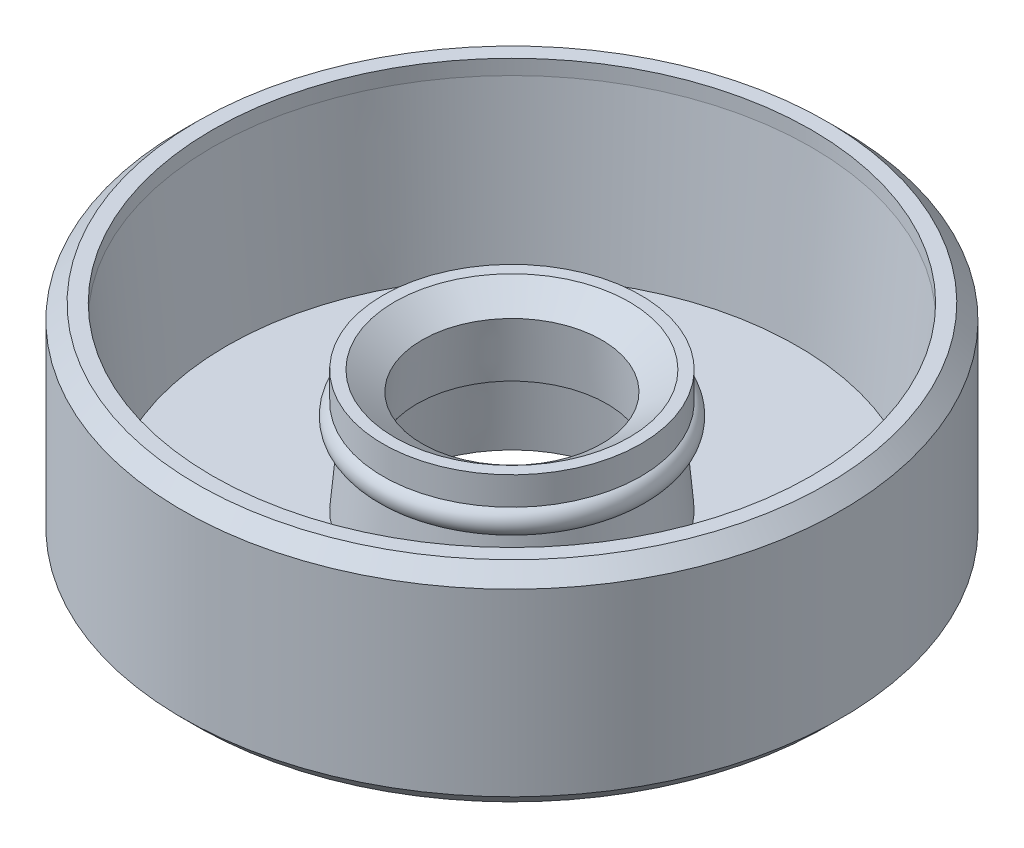
from build123d import *


with BuildPart() as part:
    # 草图1 → 旋转1 (revolve)
    with BuildSketch(Plane.XY):
        with BuildLine():
            Line((-9.518812351, 1), (-4.301871051, 1))
            Line((-4.301871051, 1), (-4.101871051, 3.286010461))
            ThreePointArc((-4.101871051, 3.286010461), (-4.537121231, 3.630475426), (-4.301871051, 4.133224056))
            Line((-4.301871051, 4.133224056), (-4.301871051, 5.071428571))
            Line((-4.301871051, 5.071428571), (-3.918095147, 5.071428571))
            Line((-3.918095147, 5.071428571), (-3, 4.428571429))
            Line((-3, 4.428571429), (-3.168728137, 2.5))
            Line((-3.168728137, 2.5), (-3.668728137, 2.5))
            Line((-3.668728137, 2.5), (-3.887449796, 0))
            Line((-3.887449796, 0), (-10.5, 0))
            Line((-10.5, 0), (-11, 0.5))
            Line((-11, 0.5), (-11, 6.5))
            Line((-11, 6.5), (-10.5, 7))
            Line((-10.5, 7), (-10, 7))
            Line((-10, 7), (-10, 6.5))
            Line((-10, 6.5), (-9.518812351, 1))
        make_face()
    revolve(axis=Axis((0, 5.836193369, 0), (0, -1, 0)))


solid = part.part
